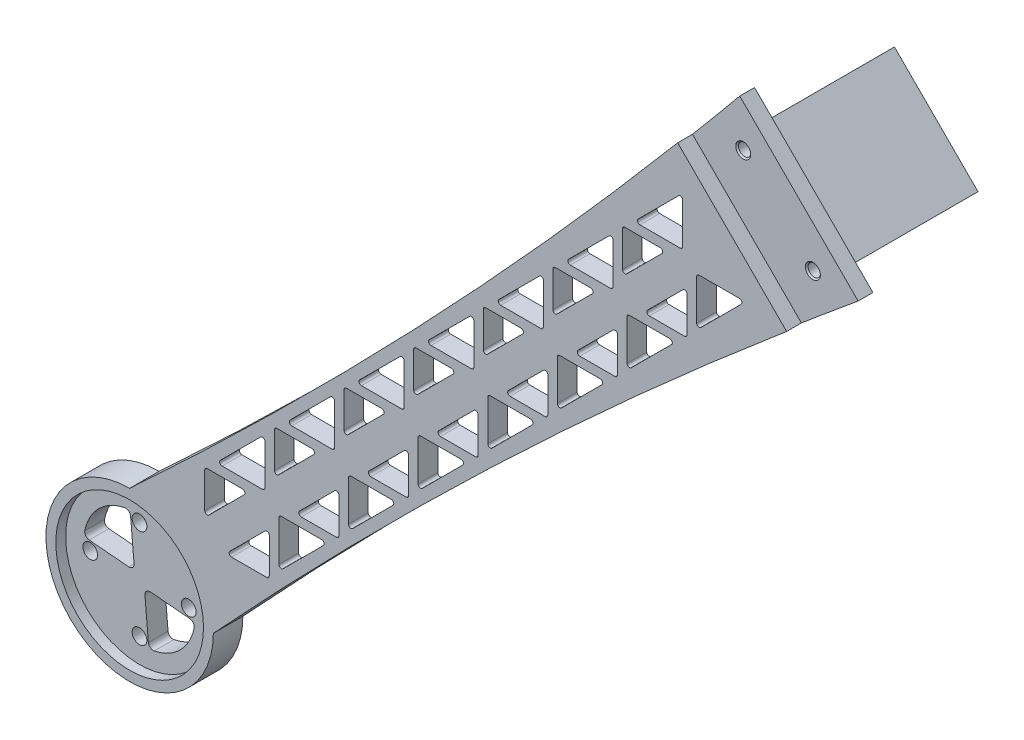
from build123d import *

# Parameters (mm, degrees)
BOSS_EXTRUDE1_DEPTH             = 6
BOSS_EXTRUDE2_DEPTH             = 3
BOSS_EXTRUDE2_DEPTH_BACK        = 3
FILLET1_R                       = 2
CUT_EXTRUDE1_DEPTH              = 3
BOSS_EXTRUDE3_DEPTH             = 27
F_3_0MM_DOWEL_HOLE2_D           = 3
F_3_0MM_DOWEL_HOLE2_DEPTH       = 4.098709071
F_3_0MM_DOWEL_HOLE2_CSINK_D     = 3.05
F_3_0MM_DOWEL_HOLE2_CSINK_ANGLE = 90
F_3_0MM_DOWEL_HOLE2_TIP         = 0.901290929
SKETCH6_R                       = 15
CUT_EXTRUDE4_DEPTH              = 2
M3_TAPPED_HOLE1_D               = 2.5
M3_TAPPED_HOLE1_DEPTH           = 4.248924226
M3_TAPPED_HOLE1_CSINK_D         = 3.05
M3_TAPPED_HOLE1_CSINK_ANGLE     = 90
M3_TAPPED_HOLE1_TIP             = 0.751075774
M3_TAPPED_HOLE2_D               = 2.5
M3_TAPPED_HOLE2_DEPTH           = 4.248924226
M3_TAPPED_HOLE2_CSINK_D         = 3.05
M3_TAPPED_HOLE2_CSINK_ANGLE     = 90
M3_TAPPED_HOLE2_TIP             = 0.751075774
CUT_EXTRUDE5_DEPTH              = 4
CUT_EXTRUDE6_DEPTH              = 2
CUT_EXTRUDE8_DEPTH              = 9
LPATTERN1_COUNT                 = 7
LPATTERN1_PITCH                 = 20
MIRROR2_COPY_1_DEPTH            = 9
MIRROR2_COPY_2_DEPTH            = 9
MIRROR2_COPY_3_DEPTH            = 9
MIRROR2_COPY_4_DEPTH            = 9
MIRROR2_COPY_5_DEPTH            = 9
MIRROR2_COPY_6_DEPTH            = 9
CUT_EXTRUDE9_DEPTH              = 39
LPATTERN2_COUNT                 = 7
LPATTERN2_PITCH                 = 20
MIRROR3_COPY_1_DEPTH            = 39
MIRROR3_COPY_2_DEPTH            = 39
MIRROR3_COPY_3_DEPTH            = 39
MIRROR3_COPY_4_DEPTH            = 39
MIRROR3_COPY_5_DEPTH            = 39
MIRROR3_COPY_6_DEPTH            = 39
CUT_EXTRUDE10_DEPTH             = 9


with BuildPart() as part:
    # Sketch1 → Boss-Extrude1 (new body)
    with BuildSketch(Plane.XY):
        with BuildLine():
            Line((-60.02081528, -35.97918472), (-35.97918472, -60.02081528))
            ThreePointArc((-35.97918472, -60.02081528), (-102.00681633, -118.309921944), (-163.936074863, -180.936074863))
            ThreePointArc((-163.936074863, -180.936074863), (-192.956890143, -192.956890143), (-180.936074863, -163.936074863))
            ThreePointArc((-180.936074863, -163.936074863), (-118.309921944, -102.00681633), (-60.02081528, -35.97918472))
        make_face()
    extrude(amount=BOSS_EXTRUDE1_DEPTH)

    # Sketch3 → Boss-Extrude2 (add, two sides: drawn at the far end of the back side and taken through both)
    with BuildSketch(Plane(origin=(0, 0, 0), x_dir=(-0.7071067811865474, -0.7071067811865477, 0), z_dir=(-0.7071067811865477, 0.7071067811865474, 0)).offset(-BOSS_EXTRUDE2_DEPTH_BACK)):
        Polygon((266.882250994, 0), (252.323441623, -40), (240.323441623, -40), (240.323441623, 0), align=None)
    extrude(amount=BOSS_EXTRUDE2_DEPTH + BOSS_EXTRUDE2_DEPTH_BACK)

    # Fillet1
    fillet1_edges = [part.edges().sort_by_distance(p)[0] for p in [
        (-178.419616624, -178.419616624, -40),
        (-169.93433525, -169.93433525, -40),
    ]]
    fillet(fillet1_edges, radius=FILLET1_R)

    # Sketch4 → Cut-Extrude1 (cut)
    with BuildSketch(Plane.XY.offset(6)):
        Polygon((-60.02081528, -35.97918472), (-35.97918472, -60.02081528), (-47.498860841, -69.627951277), (-69.627951277, -47.498860841), align=None)
    extrude(amount=-CUT_EXTRUDE1_DEPTH, mode=Mode.SUBTRACT)

    # Sketch5 → Boss-Extrude3 (add)
    with BuildSketch(Plane(origin=(0, 0, 0), x_dir=(-1, 0, 0), z_dir=(0, 0, -1))):
        Polygon((41.636038969, -58.606601718), (58.606601718, -41.636038969), (62.849242405, -45.878679656), (45.878679656, -62.849242405), align=None)
    extrude(amount=BOSS_EXTRUDE3_DEPTH)

    # Ø3.0mm Dowel Hole2
    with Locations(Plane(origin=(-170.936074863, -180.936074863, 6), x_dir=(1, 0, 0), z_dir=(0, 0, 1))):
        with Locations((0, 0), (-10, 10), (-20, 0), (-10, -10)):
            CounterSinkHole(F_3_0MM_DOWEL_HOLE2_D / 2, F_3_0MM_DOWEL_HOLE2_CSINK_D / 2, depth=F_3_0MM_DOWEL_HOLE2_DEPTH, counter_sink_angle=F_3_0MM_DOWEL_HOLE2_CSINK_ANGLE)
            with Locations((0, 0, -(F_3_0MM_DOWEL_HOLE2_DEPTH + F_3_0MM_DOWEL_HOLE2_TIP / 2))):  # 118° drill point
                Cone(0, F_3_0MM_DOWEL_HOLE2_D / 2, F_3_0MM_DOWEL_HOLE2_TIP, mode=Mode.SUBTRACT)

    # Sketch6 → Cut-Extrude4 (cut)
    with BuildSketch(Plane.XY.offset(6)):
        with Locations((-180.936074863, -180.936074863)):
            Circle(SKETCH6_R)
    extrude(amount=-CUT_EXTRUDE4_DEPTH, mode=Mode.SUBTRACT)

    # M3 Tapped Hole1
    with Locations(Plane(origin=(-59.313708499, -45.171572875, 3), x_dir=(1, 0, 0), z_dir=(0, 0, 1))):
        with Locations((0, 0), (14.142135624, -14.142135624)):
            CounterSinkHole(M3_TAPPED_HOLE1_D / 2, M3_TAPPED_HOLE1_CSINK_D / 2, depth=M3_TAPPED_HOLE1_DEPTH, counter_sink_angle=M3_TAPPED_HOLE1_CSINK_ANGLE)
            with Locations((0, 0, -(M3_TAPPED_HOLE1_DEPTH + M3_TAPPED_HOLE1_TIP / 2))):  # 118° drill point
                Cone(0, M3_TAPPED_HOLE1_D / 2, M3_TAPPED_HOLE1_TIP, mode=Mode.SUBTRACT)

    # M3 Tapped Hole2
    with Locations(Plane(origin=(0, 0, -27), x_dir=(-1, 0, 0), z_dir=(0, 0, -1))):
        with Locations((46.585786438, -57.899494937), (57.899494937, -46.585786438)):
            CounterSinkHole(M3_TAPPED_HOLE2_D / 2, M3_TAPPED_HOLE2_CSINK_D / 2, depth=M3_TAPPED_HOLE2_DEPTH, counter_sink_angle=M3_TAPPED_HOLE2_CSINK_ANGLE)
            with Locations((0, 0, -(M3_TAPPED_HOLE2_DEPTH + M3_TAPPED_HOLE2_TIP / 2))):  # 118° drill point
                Cone(0, M3_TAPPED_HOLE2_D / 2, M3_TAPPED_HOLE2_TIP, mode=Mode.SUBTRACT)

    # Sketch13 → Cut-Extrude5 (cut)
    with BuildSketch(Plane.XY.offset(4)):
        with BuildLine():
            Line((-183.123293473, -179.832206694), (-191.146053486, -179.130306142))
            ThreePointArc((-191.146053486, -179.130306142), (-191.858442905, -178.734717417), (-192.039943033, -177.940332858))
            ThreePointArc((-192.039943033, -177.940332858), (-189.218627236, -172.65352249), (-183.931816869, -169.832206694))
            ThreePointArc((-183.931816869, -169.832206694), (-183.137432309, -170.013706821), (-182.741843584, -170.72609624))
            Line((-182.741843584, -170.72609624), (-182.039943033, -178.748856253))
            ThreePointArc((-182.039943033, -178.748856253), (-182.32903095, -179.543118777), (-183.123293473, -179.832206694))
        make_face()
        with BuildLine():
            Line((-178.748856253, -182.039943033), (-170.72609624, -182.741843584))
            ThreePointArc((-170.72609624, -182.741843584), (-170.013706821, -183.137432309), (-169.832206694, -183.931816869))
            ThreePointArc((-169.832206694, -183.931816869), (-172.65352249, -189.218627236), (-177.940332858, -192.039943033))
            ThreePointArc((-177.940332858, -192.039943033), (-178.734717417, -191.858442905), (-179.130306142, -191.146053486))
            Line((-179.130306142, -191.146053486), (-179.832206694, -183.123293473))
            ThreePointArc((-179.832206694, -183.123293473), (-179.543118777, -182.32903095), (-178.748856253, -182.039943033))
        make_face()
    extrude(amount=-CUT_EXTRUDE5_DEPTH, mode=Mode.SUBTRACT)

    # Sketch16 → Cut-Extrude6 (cut)
    with BuildSketch(Plane(origin=(0, 0, 0), x_dir=(-1, 0, 0), z_dir=(0, 0, -1))):
        with BuildLine():
            Line((70.428501161, -50.768140985), (50.768140985, -70.428501161))
            ThreePointArc((50.768140985, -70.428501161), (107.594288949, -121.547007513), (161.32162555, -175.913229434))
            Line((161.32162555, -175.913229434), (175.913229434, -161.32162555))
            ThreePointArc((175.913229434, -161.32162555), (121.547007513, -107.594288949), (70.428501161, -50.768140985))
        make_face()
    extrude(amount=-CUT_EXTRUDE6_DEPTH, mode=Mode.SUBTRACT)

    # Sketch17 → Cut-Extrude8 (cut)
    with BuildSketch(Plane.XY.offset(6)):
        with BuildLine():
            Line((-65.274061489, -68.602488613), (-57.081673333, -68.602488613))
            ThreePointArc((-57.081673333, -68.602488613), (-56.619733567, -68.911146897), (-56.728119943, -69.456042004))
            Line((-56.728119943, -69.456042004), (-64.920508098, -77.648430159))
            ThreePointArc((-64.920508098, -77.648430159), (-65.465403205, -77.756816535), (-65.774061489, -77.294876769))
            Line((-65.774061489, -77.294876769), (-65.774061489, -69.102488613))
            ThreePointArc((-65.774061489, -69.102488613), (-65.627614879, -68.748935223), (-65.274061489, -68.602488613))
        make_face()
    cut_extrude8 = extrude(amount=-CUT_EXTRUDE8_DEPTH, mode=Mode.SUBTRACT)

    # LPattern1: Cut-Extrude8 ×7
    with Locations(*[Vector(-0.7071067811865472, -0.7071067811865479, 0) * (i * LPATTERN1_PITCH) for i in range(1, LPATTERN1_COUNT)]):
        add(cut_extrude8, mode=Mode.SUBTRACT)

    # Mirror2: Cut-Extrude8 across plane
    add(cut_extrude8.mirror(Plane(origin=(0, 0, 0), x_dir=(0, 0, 1), z_dir=(-0.7071067811865477, 0.7071067811865474, 0))), mode=Mode.SUBTRACT)

    # Mirror2 copy 1 sketch → Mirror2 copy 1 (cut)
    with BuildSketch(Plane(origin=(-14.142135624, -14.142135624, 6), x_dir=(0, 1, 0), z_dir=(0, 0, 1))):
        with BuildLine():
            Line((-65.274061489, 68.602488613), (-57.081673333, 68.602488613))
            ThreePointArc((-57.081673333, 68.602488613), (-56.619733567, 68.911146897), (-56.728119943, 69.456042004))
            Line((-56.728119943, 69.456042004), (-64.920508098, 77.648430159))
            ThreePointArc((-64.920508098, 77.648430159), (-65.465403205, 77.756816535), (-65.774061489, 77.294876769))
            Line((-65.774061489, 77.294876769), (-65.774061489, 69.102488613))
            ThreePointArc((-65.774061489, 69.102488613), (-65.627614879, 68.748935223), (-65.274061489, 68.602488613))
        make_face()
    extrude(amount=-MIRROR2_COPY_1_DEPTH, mode=Mode.SUBTRACT)

    # Mirror2 copy 2 sketch → Mirror2 copy 2 (cut)
    with BuildSketch(Plane(origin=(-28.284271247, -28.284271247, 6), x_dir=(0, 1, 0), z_dir=(0, 0, 1))):
        with BuildLine():
            Line((-65.274061489, 68.602488613), (-57.081673333, 68.602488613))
            ThreePointArc((-57.081673333, 68.602488613), (-56.619733567, 68.911146897), (-56.728119943, 69.456042004))
            Line((-56.728119943, 69.456042004), (-64.920508098, 77.648430159))
            ThreePointArc((-64.920508098, 77.648430159), (-65.465403205, 77.756816535), (-65.774061489, 77.294876769))
            Line((-65.774061489, 77.294876769), (-65.774061489, 69.102488613))
            ThreePointArc((-65.774061489, 69.102488613), (-65.627614879, 68.748935223), (-65.274061489, 68.602488613))
        make_face()
    extrude(amount=-MIRROR2_COPY_2_DEPTH, mode=Mode.SUBTRACT)

    # Mirror2 copy 3 sketch → Mirror2 copy 3 (cut)
    with BuildSketch(Plane(origin=(-42.426406871, -42.426406871, 6), x_dir=(0, 1, 0), z_dir=(0, 0, 1))):
        with BuildLine():
            Line((-65.274061489, 68.602488613), (-57.081673333, 68.602488613))
            ThreePointArc((-57.081673333, 68.602488613), (-56.619733567, 68.911146897), (-56.728119943, 69.456042004))
            Line((-56.728119943, 69.456042004), (-64.920508098, 77.648430159))
            ThreePointArc((-64.920508098, 77.648430159), (-65.465403205, 77.756816535), (-65.774061489, 77.294876769))
            Line((-65.774061489, 77.294876769), (-65.774061489, 69.102488613))
            ThreePointArc((-65.774061489, 69.102488613), (-65.627614879, 68.748935223), (-65.274061489, 68.602488613))
        make_face()
    extrude(amount=-MIRROR2_COPY_3_DEPTH, mode=Mode.SUBTRACT)

    # Mirror2 copy 4 sketch → Mirror2 copy 4 (cut)
    with BuildSketch(Plane(origin=(-56.568542495, -56.568542495, 6), x_dir=(0, 1, 0), z_dir=(0, 0, 1))):
        with BuildLine():
            Line((-65.274061489, 68.602488613), (-57.081673333, 68.602488613))
            ThreePointArc((-57.081673333, 68.602488613), (-56.619733567, 68.911146897), (-56.728119943, 69.456042004))
            Line((-56.728119943, 69.456042004), (-64.920508098, 77.648430159))
            ThreePointArc((-64.920508098, 77.648430159), (-65.465403205, 77.756816535), (-65.774061489, 77.294876769))
            Line((-65.774061489, 77.294876769), (-65.774061489, 69.102488613))
            ThreePointArc((-65.774061489, 69.102488613), (-65.627614879, 68.748935223), (-65.274061489, 68.602488613))
        make_face()
    extrude(amount=-MIRROR2_COPY_4_DEPTH, mode=Mode.SUBTRACT)

    # Mirror2 copy 5 sketch → Mirror2 copy 5 (cut)
    with BuildSketch(Plane(origin=(-70.710678119, -70.710678119, 6), x_dir=(0, 1, 0), z_dir=(0, 0, 1))):
        with BuildLine():
            Line((-65.274061489, 68.602488613), (-57.081673333, 68.602488613))
            ThreePointArc((-57.081673333, 68.602488613), (-56.619733567, 68.911146897), (-56.728119943, 69.456042004))
            Line((-56.728119943, 69.456042004), (-64.920508098, 77.648430159))
            ThreePointArc((-64.920508098, 77.648430159), (-65.465403205, 77.756816535), (-65.774061489, 77.294876769))
            Line((-65.774061489, 77.294876769), (-65.774061489, 69.102488613))
            ThreePointArc((-65.774061489, 69.102488613), (-65.627614879, 68.748935223), (-65.274061489, 68.602488613))
        make_face()
    extrude(amount=-MIRROR2_COPY_5_DEPTH, mode=Mode.SUBTRACT)

    # Mirror2 copy 6 sketch → Mirror2 copy 6 (cut)
    with BuildSketch(Plane(origin=(-84.852813742, -84.852813742, 6), x_dir=(0, 1, 0), z_dir=(0, 0, 1))):
        with BuildLine():
            Line((-65.274061489, 68.602488613), (-57.081673333, 68.602488613))
            ThreePointArc((-57.081673333, 68.602488613), (-56.619733567, 68.911146897), (-56.728119943, 69.456042004))
            Line((-56.728119943, 69.456042004), (-64.920508098, 77.648430159))
            ThreePointArc((-64.920508098, 77.648430159), (-65.465403205, 77.756816535), (-65.774061489, 77.294876769))
            Line((-65.774061489, 77.294876769), (-65.774061489, 69.102488613))
            ThreePointArc((-65.774061489, 69.102488613), (-65.627614879, 68.748935223), (-65.274061489, 68.602488613))
        make_face()
    extrude(amount=-MIRROR2_COPY_6_DEPTH, mode=Mode.SUBTRACT)

    # Sketch18 → Cut-Extrude9 (cut)
    with BuildSketch(Plane.XY.offset(6)):
        with BuildLine():
            Line((-79.97918786, -75.736547173), (-72.821902608, -68.579261921))
            ThreePointArc((-72.821902608, -68.579261921), (-72.713516233, -68.034366814), (-73.175455999, -67.72570853))
            Line((-73.175455999, -67.72570853), (-80.33274125, -67.72570853))
            ThreePointArc((-80.33274125, -67.72570853), (-80.686294641, -67.87215514), (-80.83274125, -68.22570853))
            Line((-80.83274125, -68.22570853), (-80.83274125, -75.382993782))
            ThreePointArc((-80.83274125, -75.382993782), (-80.524082966, -75.844933548), (-79.97918786, -75.736547173))
        make_face()
    cut_extrude9 = extrude(amount=-CUT_EXTRUDE9_DEPTH, mode=Mode.SUBTRACT)

    # LPattern2: Cut-Extrude9 ×7
    with Locations(*[Vector(-0.7071067811865472, -0.7071067811865479, 0) * (i * LPATTERN2_PITCH) for i in range(1, LPATTERN2_COUNT)]):
        add(cut_extrude9, mode=Mode.SUBTRACT)

    # Mirror3: Cut-Extrude9 across plane
    add(cut_extrude9.mirror(Plane(origin=(0, 0, 0), x_dir=(0, 0, 1), z_dir=(-0.7071067811865477, 0.7071067811865474, 0))), mode=Mode.SUBTRACT)

    # Mirror3 copy 1 sketch → Mirror3 copy 1 (cut)
    with BuildSketch(Plane(origin=(-14.142135624, -14.142135624, 6), x_dir=(0, 1, 0), z_dir=(0, 0, 1))):
        with BuildLine():
            Line((-79.97918786, 75.736547173), (-72.821902608, 68.579261921))
            ThreePointArc((-72.821902608, 68.579261921), (-72.713516233, 68.034366814), (-73.175455999, 67.72570853))
            Line((-73.175455999, 67.72570853), (-80.33274125, 67.72570853))
            ThreePointArc((-80.33274125, 67.72570853), (-80.686294641, 67.87215514), (-80.83274125, 68.22570853))
            Line((-80.83274125, 68.22570853), (-80.83274125, 75.382993782))
            ThreePointArc((-80.83274125, 75.382993782), (-80.524082966, 75.844933548), (-79.97918786, 75.736547173))
        make_face()
    extrude(amount=-MIRROR3_COPY_1_DEPTH, mode=Mode.SUBTRACT)

    # Mirror3 copy 2 sketch → Mirror3 copy 2 (cut)
    with BuildSketch(Plane(origin=(-28.284271247, -28.284271247, 6), x_dir=(0, 1, 0), z_dir=(0, 0, 1))):
        with BuildLine():
            Line((-79.97918786, 75.736547173), (-72.821902608, 68.579261921))
            ThreePointArc((-72.821902608, 68.579261921), (-72.713516233, 68.034366814), (-73.175455999, 67.72570853))
            Line((-73.175455999, 67.72570853), (-80.33274125, 67.72570853))
            ThreePointArc((-80.33274125, 67.72570853), (-80.686294641, 67.87215514), (-80.83274125, 68.22570853))
            Line((-80.83274125, 68.22570853), (-80.83274125, 75.382993782))
            ThreePointArc((-80.83274125, 75.382993782), (-80.524082966, 75.844933548), (-79.97918786, 75.736547173))
        make_face()
    extrude(amount=-MIRROR3_COPY_2_DEPTH, mode=Mode.SUBTRACT)

    # Mirror3 copy 3 sketch → Mirror3 copy 3 (cut)
    with BuildSketch(Plane(origin=(-42.426406871, -42.426406871, 6), x_dir=(0, 1, 0), z_dir=(0, 0, 1))):
        with BuildLine():
            Line((-79.97918786, 75.736547173), (-72.821902608, 68.579261921))
            ThreePointArc((-72.821902608, 68.579261921), (-72.713516233, 68.034366814), (-73.175455999, 67.72570853))
            Line((-73.175455999, 67.72570853), (-80.33274125, 67.72570853))
            ThreePointArc((-80.33274125, 67.72570853), (-80.686294641, 67.87215514), (-80.83274125, 68.22570853))
            Line((-80.83274125, 68.22570853), (-80.83274125, 75.382993782))
            ThreePointArc((-80.83274125, 75.382993782), (-80.524082966, 75.844933548), (-79.97918786, 75.736547173))
        make_face()
    extrude(amount=-MIRROR3_COPY_3_DEPTH, mode=Mode.SUBTRACT)

    # Mirror3 copy 4 sketch → Mirror3 copy 4 (cut)
    with BuildSketch(Plane(origin=(-56.568542495, -56.568542495, 6), x_dir=(0, 1, 0), z_dir=(0, 0, 1))):
        with BuildLine():
            Line((-79.97918786, 75.736547173), (-72.821902608, 68.579261921))
            ThreePointArc((-72.821902608, 68.579261921), (-72.713516233, 68.034366814), (-73.175455999, 67.72570853))
            Line((-73.175455999, 67.72570853), (-80.33274125, 67.72570853))
            ThreePointArc((-80.33274125, 67.72570853), (-80.686294641, 67.87215514), (-80.83274125, 68.22570853))
            Line((-80.83274125, 68.22570853), (-80.83274125, 75.382993782))
            ThreePointArc((-80.83274125, 75.382993782), (-80.524082966, 75.844933548), (-79.97918786, 75.736547173))
        make_face()
    extrude(amount=-MIRROR3_COPY_4_DEPTH, mode=Mode.SUBTRACT)

    # Mirror3 copy 5 sketch → Mirror3 copy 5 (cut)
    with BuildSketch(Plane(origin=(-70.710678119, -70.710678119, 6), x_dir=(0, 1, 0), z_dir=(0, 0, 1))):
        with BuildLine():
            Line((-79.97918786, 75.736547173), (-72.821902608, 68.579261921))
            ThreePointArc((-72.821902608, 68.579261921), (-72.713516233, 68.034366814), (-73.175455999, 67.72570853))
            Line((-73.175455999, 67.72570853), (-80.33274125, 67.72570853))
            ThreePointArc((-80.33274125, 67.72570853), (-80.686294641, 67.87215514), (-80.83274125, 68.22570853))
            Line((-80.83274125, 68.22570853), (-80.83274125, 75.382993782))
            ThreePointArc((-80.83274125, 75.382993782), (-80.524082966, 75.844933548), (-79.97918786, 75.736547173))
        make_face()
    extrude(amount=-MIRROR3_COPY_5_DEPTH, mode=Mode.SUBTRACT)

    # Mirror3 copy 6 sketch → Mirror3 copy 6 (cut)
    with BuildSketch(Plane(origin=(-84.852813742, -84.852813742, 6), x_dir=(0, 1, 0), z_dir=(0, 0, 1))):
        with BuildLine():
            Line((-79.97918786, 75.736547173), (-72.821902608, 68.579261921))
            ThreePointArc((-72.821902608, 68.579261921), (-72.713516233, 68.034366814), (-73.175455999, 67.72570853))
            Line((-73.175455999, 67.72570853), (-80.33274125, 67.72570853))
            ThreePointArc((-80.33274125, 67.72570853), (-80.686294641, 67.87215514), (-80.83274125, 68.22570853))
            Line((-80.83274125, 68.22570853), (-80.83274125, 75.382993782))
            ThreePointArc((-80.83274125, 75.382993782), (-80.524082966, 75.844933548), (-79.97918786, 75.736547173))
        make_face()
    extrude(amount=-MIRROR3_COPY_6_DEPTH, mode=Mode.SUBTRACT)

    # Sketch19 → Cut-Extrude10 (cut)
    with BuildSketch(Plane(origin=(2.121320344, -2.121320344, 0), x_dir=(0, 0, -1), z_dir=(0.7071067811865477, -0.7071067811865475, 0))):
        with BuildLine():
            Line((3, -242.323441623), (16, -242.323441623))
            ThreePointArc((16, -242.323441623), (16.707106781, -242.616334842), (17, -243.323441623))
            Line((17, -243.323441623), (17, -257.866193928))
            ThreePointArc((17, -257.866193928), (16.819152044, -258.439770365), (16.342020143, -258.805886549))
            Line((16.342020143, -258.805886549), (3.342020143, -263.537499594))
            ThreePointArc((3.342020143, -263.537499594), (2.426423564, -263.416959018), (2, -262.597806974))
            Line((2, -262.597806974), (2, -243.323441623))
            ThreePointArc((2, -243.323441623), (2.292893219, -242.616334842), (3, -242.323441623))
        make_face()
        with BuildLine():
            Line((22, -242.323441623), (36.693101342, -242.323441623))
            ThreePointArc((36.693101342, -242.323441623), (37.400208123, -242.616334842), (37.693101342, -243.323441623))
            Line((37.693101342, -243.323441623), (37.693101342, -250.14471437))
            ThreePointArc((37.693101342, -250.14471437), (37.512253386, -250.718290806), (37.035121485, -251.084406991))
            Line((37.035121485, -251.084406991), (22.342020143, -256.432258528))
            ThreePointArc((22.342020143, -256.432258528), (21.426423564, -256.311717952), (21, -255.492565907))
            Line((21, -255.492565907), (21, -243.323441623))
            ThreePointArc((21, -243.323441623), (21.292893219, -242.616334842), (22, -242.323441623))
        make_face()
    extrude(amount=-CUT_EXTRUDE10_DEPTH, mode=Mode.SUBTRACT)


solid = part.part
